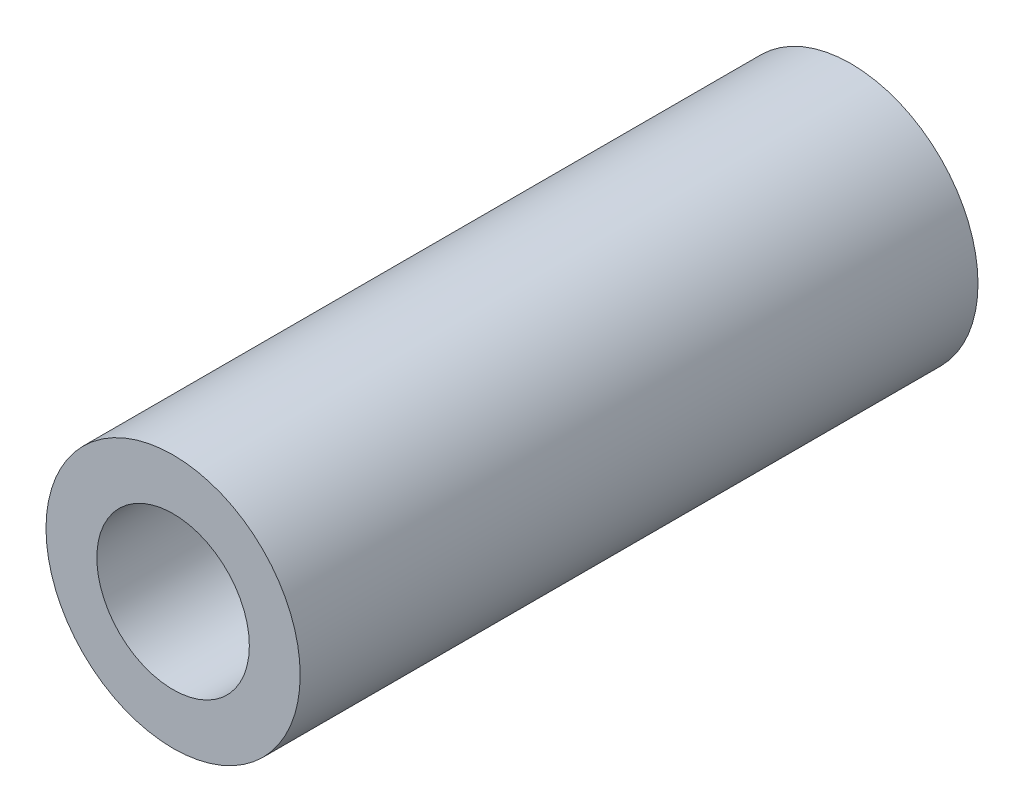
from build123d import *

# Parameters (mm, degrees)
SKETCH_1_R      = 7.5
SKETCH_1_R_2    = 4.5
EXTRUDE_1_DEPTH = 20


with BuildPart() as part:
    # 草图1 → 凸台-拉伸1 (new, symmetric)
    with BuildSketch(Plane.XY):
        Circle(SKETCH_1_R)
        Circle(SKETCH_1_R_2, mode=Mode.SUBTRACT)
    extrude(amount=EXTRUDE_1_DEPTH, both=True)


solid = part.part
